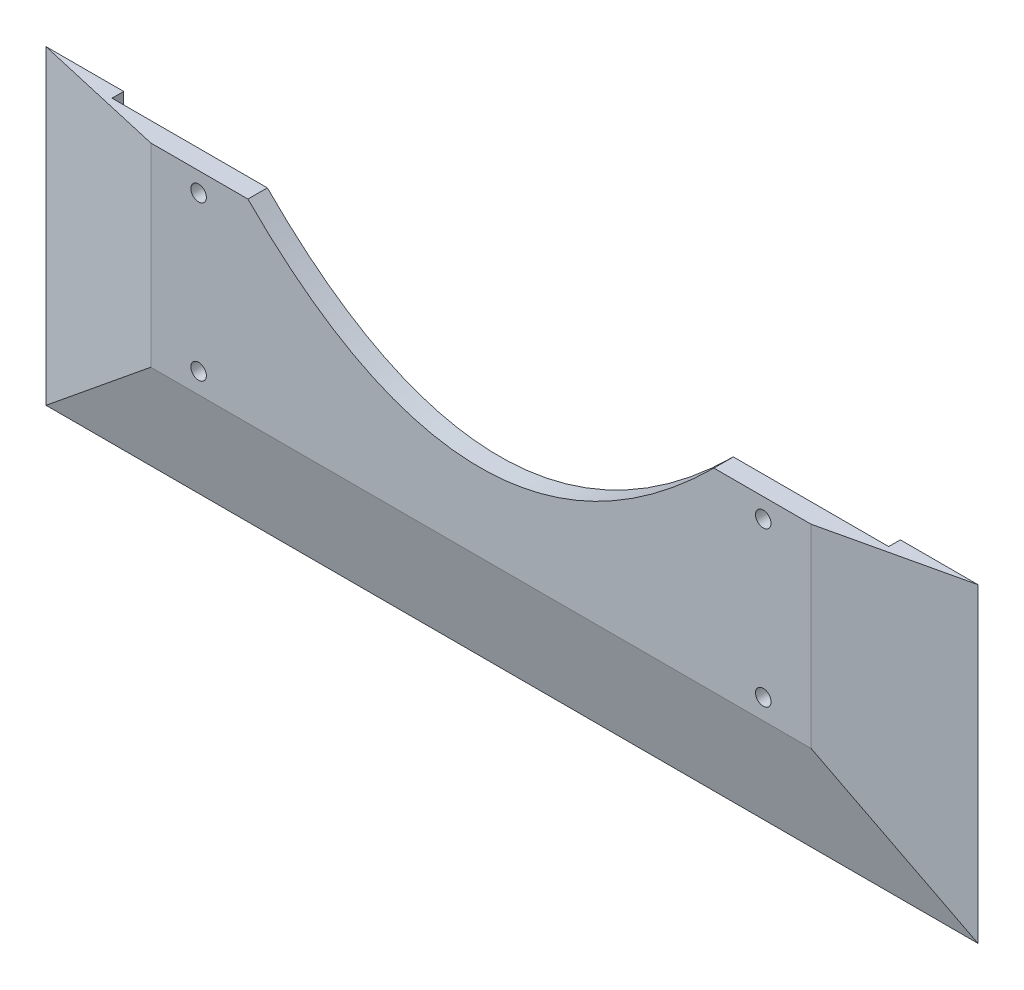
from build123d import *

# Parameters (mm, degrees)
SKETCH_1_W           = 200
SKETCH_1_H           = 90
EXTRUDE_1_DEPTH      = 8
CUT_EXTRUDE_2_DEPTH  = 206.156038176
SKETCH_7_W           = 200
SKETCH_7_H           = 10
CUT_EXTRUDE_6_DEPTH  = 110.949988631
CUT_EXTRUDE_7_DEPTH  = 110.949988631
EXTRUDE_2_DEPTH      = 20
EXTRUDE_3_DEPTH      = 20
CUT_EXTRUDE_8_DEPTH  = 145.443760826
SKETCH_12_R          = 2
CUT_EXTRUDE_9_DEPTH  = 129.409501341
CUT_EXTRUDE_10_DEPTH = 3


with BuildPart() as part:
    # 草图1 → 凸台-拉伸1 (new body)
    with BuildSketch(Plane.XY):
        Rectangle(SKETCH_1_W, SKETCH_1_H)
    extrude(amount=EXTRUDE_1_DEPTH)

    # 草图3 → 切除-拉伸2 (cut, through all)
    with BuildSketch(Plane.ZY.offset(100)):
        Polygon((0, -45), (8, -15), (8, -45), align=None)
    extrude(amount=-CUT_EXTRUDE_2_DEPTH, mode=Mode.SUBTRACT)

    # 草图7 → 切除-拉伸6 (cut, through all)
    with BuildSketch(Plane(origin=(0, 0, 0), x_dir=(-1, 0, 0), z_dir=(0, 0, -1))):
        with Locations((0, 40)):
            Rectangle(SKETCH_7_W, SKETCH_7_H)
    extrude(amount=-CUT_EXTRUDE_6_DEPTH, mode=Mode.SUBTRACT)

    # 草图8 → 切除-拉伸7 (cut, through all)
    with BuildSketch(Plane(origin=(0, 0, 0), x_dir=(-1, 0, 0), z_dir=(0, 0, -1))):
        with BuildLine():
            Line((60, 35), (-60, 35))
            add(Edge.make_bspline(
                [(60, 35), (0.461478769, -25.014185767), (-60, 35)],
                knots=[0, 0, 0, 1, 1, 1], degree=2))
        make_face()
    extrude(amount=-CUT_EXTRUDE_7_DEPTH, mode=Mode.SUBTRACT)

    # 草图9 → 凸台-拉伸2 (add)
    with BuildSketch(Plane.ZY.offset(100)):
        Polygon((8, -15), (8, 35), (0, 35), (0, -45), align=None)
    extrude(amount=EXTRUDE_2_DEPTH)

    # 草图10 → 凸台-拉伸3 (add)
    with BuildSketch(Plane(origin=(100, 0, 0), x_dir=(0, 0, -1), z_dir=(1, 0, 0))):
        Polygon((0, -45), (0, 35), (-8, 35), (-8, -15), align=None)
    extrude(amount=EXTRUDE_3_DEPTH)

    # 草图11 → 切除-拉伸8 (cut, through all)
    with BuildSketch(Plane(origin=(0, 35, 0), x_dir=(1, 0, 0), z_dir=(0, 1, 0))):
        Polygon((120, 0), (120, -8), (85, -8), align=None)
        Polygon((-120, 0), (-120, -8), (-85, -8), align=None)
    extrude(amount=-CUT_EXTRUDE_8_DEPTH, mode=Mode.SUBTRACT)

    # 草图12 → 切除-拉伸9 (cut, through all)
    with BuildSketch(Plane.XY.offset(8)):
        with Locations((72.7, -9.757802573)):
            Circle(SKETCH_12_R)
        with Locations((-72.7, -9.757802573)):
            Circle(SKETCH_12_R)
        with Locations((72.7, 30)):
            Circle(SKETCH_12_R)
        with Locations((-72.7, 30)):
            Circle(SKETCH_12_R)
    extrude(amount=-CUT_EXTRUDE_9_DEPTH, mode=Mode.SUBTRACT)

    # 草图13 → 切除-拉伸10 (cut)
    with BuildSketch(Plane(origin=(0, 0, 0), x_dir=(-1, 0, 0), z_dir=(0, 0, -1))):
        with BuildLine():
            Line((-59.999999976, 34.999999976), (-100, 35))
            Line((-100, 35), (-100, -25))
            Line((-100, -25), (100, -25))
            Line((100, -25), (100, 35))
            Line((100, 35), (60, 35))
            add(Edge.make_bspline(
                [(60, 35), (0.461478781, -25.014185755), (-59.999999976, 34.999999976)],
                knots=[0, 0, 0, 1, 1, 1], degree=2))
        make_face()
    extrude(amount=-CUT_EXTRUDE_10_DEPTH, mode=Mode.SUBTRACT)


solid = part.part
